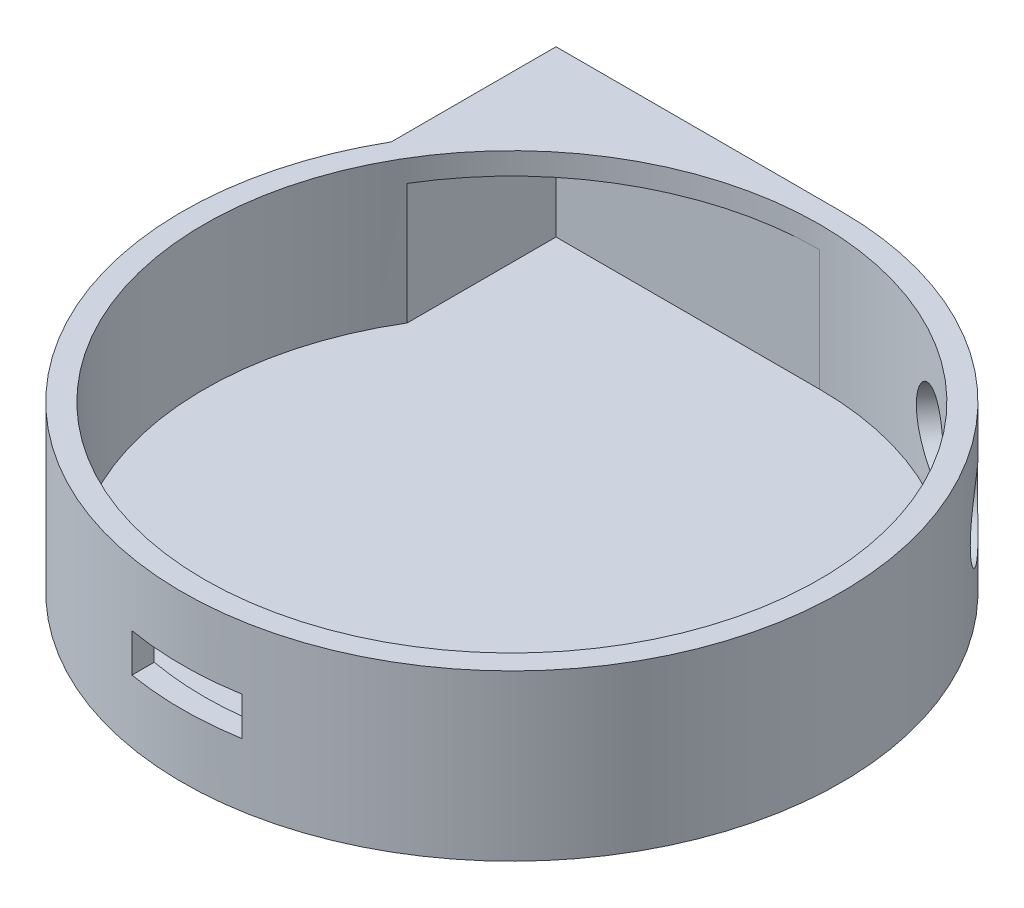
from build123d import *

# Parameters (mm, degrees)
BOSS_EXTRUDE1_DEPTH      = 2
BOSS_EXTRUDE2_DEPTH      = 13
BOSS_EXTRUDE3_START      = -2
BOSS_EXTRUDE3_DEPTH      = 2
SKETCH4_R                = 12.5
CUT_EXTRUDE2_DEPTH       = 1
SKETCH5_W                = 10
SKETCH5_H                = 3.5
USB_C_CUT_DEPTH          = 4
SKETCH6_R                = 3.5
VOLUME_BUTTONS_CUT_DEPTH = 4


with BuildPart() as part:
    # Sketch1 → Boss-Extrude1 (new body)
    with BuildSketch(Plane(origin=(0, 0, 0), x_dir=(1, 0, 0), z_dir=(0, 1, 0))):
        with BuildLine():
            Line((-25.980762114, 15), (-25.980762114, 30))
            Line((-25.980762114, 30), (0, 30))
            ThreePointArc((0, 30), (15, -25.980762114), (-25.980762114, 15))
        make_face()
    extrude(amount=BOSS_EXTRUDE1_DEPTH)

    # Sketch2 → Boss-Extrude2 (add)
    with BuildSketch(Plane(origin=(0, 2, 0), x_dir=(1, 0, 0), z_dir=(0, 1, 0))):
        with BuildLine():
            Line((0, 30), (-25.980762114, 30))
            Line((-25.980762114, 30), (-25.980762114, 15))
            ThreePointArc((-25.980762114, 15), (15, -25.980762114), (0, 30))
        make_face()
        with BuildLine():
            Line((0, 28), (-23.980762114, 28))
            Line((-23.980762114, 28), (-23.980762114, 14.454170625))
            ThreePointArc((-23.980762114, 14.454170625), (13.77104249, -24.379466539), (0, 28))
        make_face(mode=Mode.SUBTRACT)
    extrude(amount=BOSS_EXTRUDE2_DEPTH)

    # Sketch3 → Boss-Extrude3 (add)
    with BuildSketch(Plane(origin=(0, 15, 0), x_dir=(1, 0, 0), z_dir=(0, 1, 0)).offset(BOSS_EXTRUDE3_START)):
        with BuildLine():
            Line((-23.980762114, 14.454170625), (-23.980762114, 28))
            Line((-23.980762114, 28), (0, 28))
            ThreePointArc((0, 28), (-13.77104249, 24.379466539), (-23.980762114, 14.454170625))
        make_face()
    extrude(amount=BOSS_EXTRUDE3_DEPTH)

    # Sketch4 → Cut-Extrude2 (cut)
    with BuildSketch(Plane.XZ):
        with Locations(Location((0, 0, 0), (0, 0, 270))):
            Circle(SKETCH4_R)
    extrude(amount=-CUT_EXTRUDE2_DEPTH, mode=Mode.SUBTRACT)

    # Sketch5 → USB_C_Cut (cut)
    with BuildSketch(Plane.XY.offset(30)):
        with Locations((0, 7.5)):
            Rectangle(SKETCH5_W, SKETCH5_H)
    extrude(amount=-USB_C_CUT_DEPTH, mode=Mode.SUBTRACT)

    # Sketch6 → Volume_Buttons_Cut (cut)
    with BuildSketch(Plane(origin=(19.283628291, 0, -22.981333294), x_dir=(0, -1, 0), z_dir=(0.642787609686543, 0, -0.7660444431189749))):
        with Locations(Location((-7.5, 4.5, 0), (0, 0, 90))):
            Circle(SKETCH6_R)
        with Locations(Location((-7.5, -4.5, 0), (0, 0, 90))):
            Circle(SKETCH6_R)
    extrude(amount=-VOLUME_BUTTONS_CUT_DEPTH, mode=Mode.SUBTRACT)


solid = part.part
